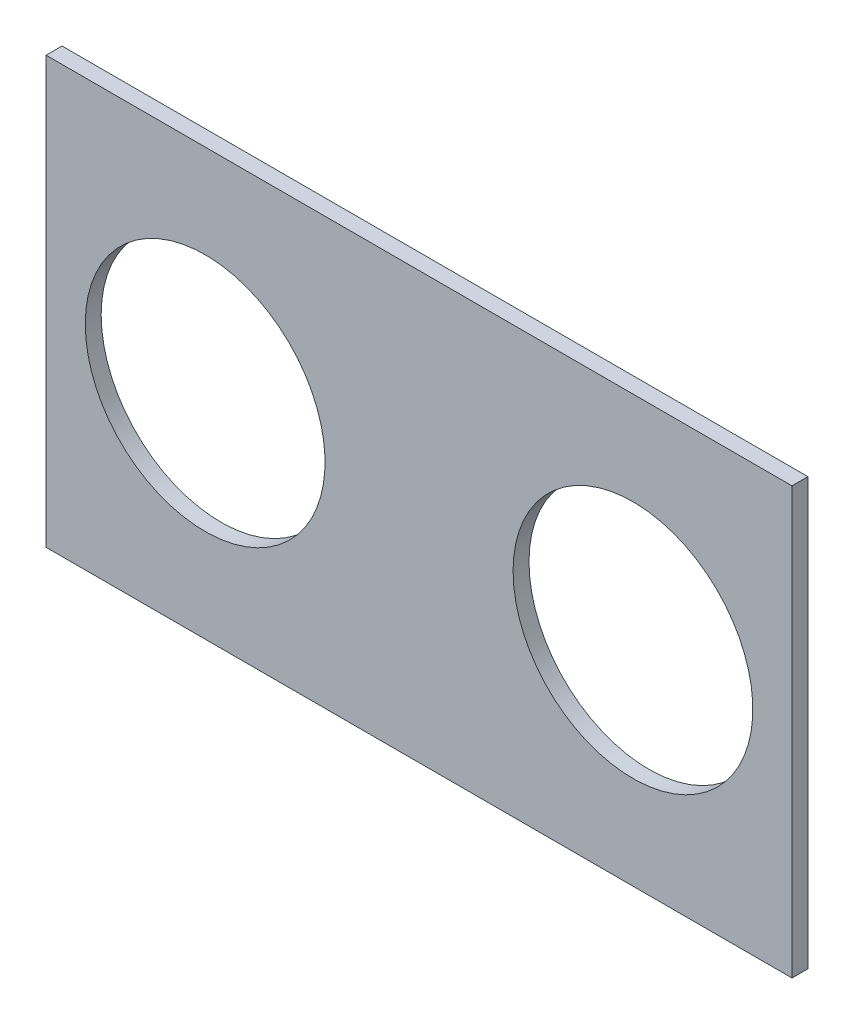
from build123d import *

# Parameters (mm, degrees)
SKETCH1_W           = 88.9
SKETCH1_H           = 50.8
SKETCH1_R           = 14.2875
BOSS_EXTRUDE1_DEPTH = 1.89738


with BuildPart() as part:
    # Sketch1 → Boss-Extrude1 (new body)
    with BuildSketch(Plane.XY):
        with Locations((25.49525, 0)):
            Rectangle(SKETCH1_W, SKETCH1_H)
        with Locations(Location((0, 0, 0), (0, 0, 180))):
            Circle(SKETCH1_R, mode=Mode.SUBTRACT)
        with Locations(Location((50.9905, 0, 0), (0, 0, 180))):
            Circle(SKETCH1_R, mode=Mode.SUBTRACT)
    extrude(amount=BOSS_EXTRUDE1_DEPTH)


solid = part.part
